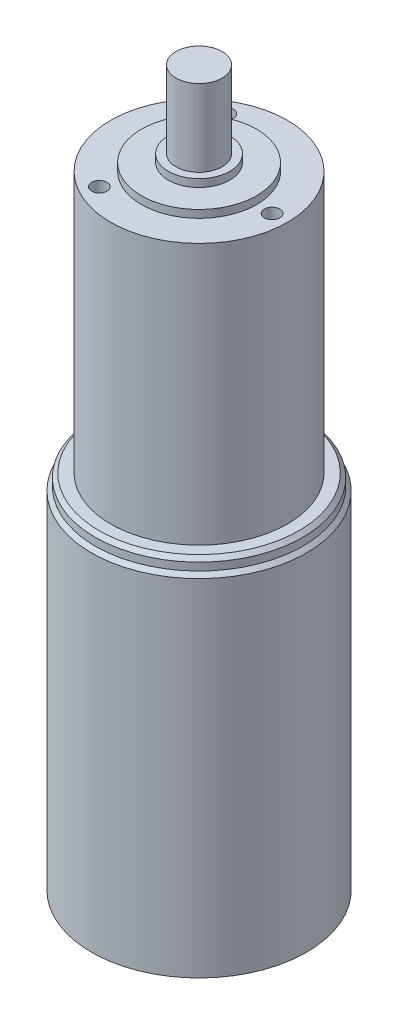
from build123d import *

# Parameters (mm, degrees)
ESQUISSE3_R             = 1
ENL_V_MAT_EXTRU_1_DEPTH = 5


with BuildPart() as part:
    # Esquisse1 → Révolution1 (revolve)
    with BuildSketch(Plane.XY, mode=Mode.PRIVATE) as r_volution1_sk:
        Polygon((0, 0), (14, 0), (14, 17), (14, 45), (13.5, 45.5), (13.5, 46.5), (13, 47), (11.5, 47), (11.5, 81), (7.5, 81), (7.5, 82), (4, 82), (4, 83), (3, 83), (3, 93), (0, 93), align=None)
    revolve(r_volution1_sk.sketch.rotate(Axis((0, 0, 0), (0, 1, 0)), 90), axis=Axis((0, 0, 0), (0, 1, 0)))

    # Esquisse3 → Enlèv. mat.-Extru.1 (cut)
    with BuildSketch(Plane(origin=(0, 81, 0), x_dir=(1, 0, 0), z_dir=(0, 1, 0))):
        with Locations(Location((9.5, 0, 0), (0, 0, 270))):
            Circle(ESQUISSE3_R)
        with Locations(Location((-4.75, -8.227241336, 0), (0, 0, 270))):
            Circle(ESQUISSE3_R)
        with Locations(Location((-4.75, 8.227241336, 0), (0, 0, 270))):
            Circle(ESQUISSE3_R)
    extrude(amount=-ENL_V_MAT_EXTRU_1_DEPTH, mode=Mode.SUBTRACT)


solid = part.part
